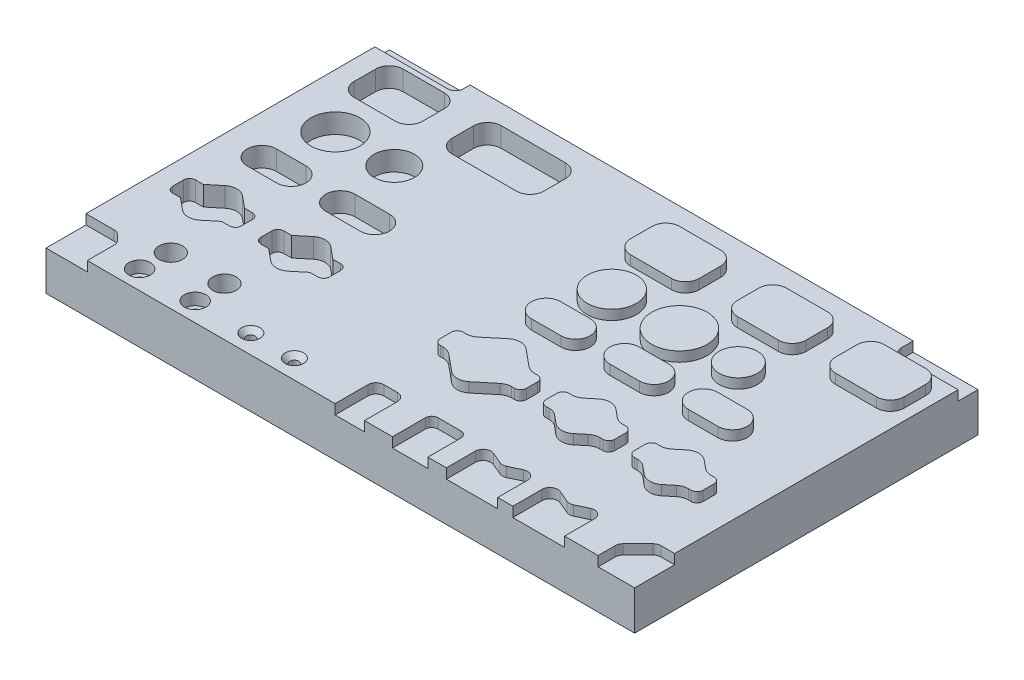
from build123d import *

# Parameters (mm, degrees)
SKETCH1_W                                       = 300
SKETCH1_H                                       = 175
BOSS_EXTRUDE1_DEPTH                             = 25
SKETCH6_R                                       = 12.5
SKETCH6_R_2                                     = 10.290350473
CUT_EXTRUDE2_DEPTH                              = 10
SKETCH8_R                                       = 12.5
SKETCH8_R_2                                     = 9.732410701
SKETCH8_R_3                                     = 14.161785941
BOSS_EXTRUDE2_DEPTH                             = 5
FILLET1_R                                       = 7
F_12_0MM_DOWEL_HOLE1_D                          = 12
F_12_0MM_DOWEL_HOLE1_DEPTH                      = 15
F_12_0MM_DOWEL_HOLE1_TIP                        = 3.605163714
CBORE_FOR_M6_SHCS1_D                            = 6.6
CBORE_FOR_M6_SHCS1_DEPTH                        = 15
CBORE_FOR_M6_SHCS1_CBORE_D                      = 11
CBORE_FOR_M6_SHCS1_CBORE_DEPTH                  = 6
CBORE_FOR_M6_SHCS1_TIP                          = 1.982840043
CSK_FOR_M4_FLAT_HEAD_MACHINE_SCREW1_D           = 4.5
CSK_FOR_M4_FLAT_HEAD_MACHINE_SCREW1_DEPTH       = 15
CSK_FOR_M4_FLAT_HEAD_MACHINE_SCREW1_CSINK_D     = 9.4
CSK_FOR_M4_FLAT_HEAD_MACHINE_SCREW1_CSINK_ANGLE = 90
CSK_FOR_M4_FLAT_HEAD_MACHINE_SCREW1_TIP         = 1.351936393
CUT_EXTRUDE3_DEPTH                              = 5
CUT_EXTRUDE6_DEPTH                              = 5


with BuildPart() as part:
    # Sketch1 → Boss-Extrude1 (new body)
    with BuildSketch(Plane(origin=(0, 0, 0), x_dir=(1, 0, 0), z_dir=(0, 1, 0))):
        with Locations((150, 87.5)):
            Rectangle(SKETCH1_W, SKETCH1_H)
    extrude(amount=-BOSS_EXTRUDE1_DEPTH)

    # Sketch6 → Cut-Extrude2 (cut)
    with BuildSketch(Plane(origin=(0, 0, 0), x_dir=(1, 0, 0), z_dir=(0, 1, 0))):
        with Locations(Location((27.5, 120, 0), (0, 0, 270))):
            Circle(SKETCH6_R)
        with Locations(Location((57.5, 120, 0), (0, 0, 270))):
            Circle(SKETCH6_R_2)
        with BuildLine():
            Line((10, 158), (10, 147))
            ThreePointArc((10, 147), (12.050252532, 142.050252532), (17, 140))
            Line((17, 140), (38, 140))
            ThreePointArc((38, 140), (42.949747468, 142.050252532), (45, 147))
            Line((45, 147), (45, 158))
            ThreePointArc((45, 158), (42.949747468, 162.949747468), (38, 165))
            Line((38, 165), (17, 165))
            ThreePointArc((17, 165), (12.050252532, 162.949747468), (10, 158))
        make_face()
        with BuildLine():
            Line((99.760567467, 165), (67, 165))
            ThreePointArc((67, 165), (62.050252532, 162.949747468), (60, 158))
            Line((60, 158), (60, 147))
            ThreePointArc((60, 147), (62.050252532, 142.050252532), (67, 140))
            Line((67, 140), (99.760567467, 140))
            ThreePointArc((99.760567467, 140), (104.710314935, 142.050252532), (106.760567467, 147))
            Line((106.760567467, 147), (106.760567467, 158))
            ThreePointArc((106.760567467, 158), (104.710314935, 162.949747468), (99.760567467, 165))
        make_face()
        with BuildLine():
            Line((35, 97.5), (20, 97.5))
            ThreePointArc((20, 97.5), (12.5, 90), (20, 82.5))
            Line((20, 82.5), (35, 82.5))
            ThreePointArc((35, 82.5), (42.5, 90), (35, 97.5))
        make_face()
        with BuildLine():
            Line((60, 82.5), (77.590637236, 82.5))
            ThreePointArc((77.590637236, 82.5), (85.090637236, 90), (77.590637236, 97.5))
            Line((77.590637236, 97.5), (60, 97.5))
            ThreePointArc((60, 97.5), (52.5, 90), (60, 82.5))
        make_face()
        with BuildLine():
            Line((45, 54.513667906), (45, 60.176281881))
            ThreePointArc((45, 60.176281881), (44.121320344, 62.297602224), (42, 63.176281881))
            Line((42, 63.176281881), (38, 63.176281881))
            Line((38, 63.176281881), (31.957646777, 68.166805351))
            ThreePointArc((31.957646777, 68.166805351), (27.5, 69.769640798), (23.042353223, 68.166805351))
            Line((23.042353223, 68.166805351), (17, 63.176281881))
            Line((17, 63.176281881), (13, 63.176281881))
            ThreePointArc((13, 63.176281881), (10.878679656, 62.297602224), (10, 60.176281881))
            Line((10, 60.176281881), (10, 54.513667906))
            ThreePointArc((10, 54.513667906), (10.878679656, 52.392347563), (13, 51.513667906))
            Line((13, 51.513667906), (17, 51.513667906))
            Line((17, 51.513667906), (23.042353223, 46.523144436))
            ThreePointArc((23.042353223, 46.523144436), (27.5, 44.920308989), (31.957646777, 46.523144436))
            Line((31.957646777, 46.523144436), (38, 51.513667906))
            Line((38, 51.513667906), (42, 51.513667906))
            ThreePointArc((42, 51.513667906), (44.121320344, 52.392347563), (45, 54.513667906))
        make_face()
        with BuildLine():
            Line((90, 54.513667906), (90, 60.176281881))
            ThreePointArc((90, 60.176281881), (89.121320344, 62.297602224), (87, 63.176281881))
            Line((87, 63.176281881), (83, 63.176281881))
            Line((83, 63.176281881), (76.957646777, 68.166805351))
            ThreePointArc((76.957646777, 68.166805351), (72.5, 69.769640798), (68.042353223, 68.166805351))
            Line((68.042353223, 68.166805351), (62, 63.176281881))
            Line((62, 63.176281881), (58, 63.176281881))
            ThreePointArc((58, 63.176281881), (55.878679656, 62.297602224), (55, 60.176281881))
            Line((55, 60.176281881), (55, 54.513667906))
            ThreePointArc((55, 54.513667906), (55.878679656, 52.392347563), (58, 51.513667906))
            Line((58, 51.513667906), (62, 51.513667906))
            Line((62, 51.513667906), (68.042353223, 46.523144436))
            ThreePointArc((68.042353223, 46.523144436), (72.5, 44.920308989), (76.957646777, 46.523144436))
            Line((76.957646777, 46.523144436), (83, 51.513667906))
            Line((83, 51.513667906), (87, 51.513667906))
            ThreePointArc((87, 51.513667906), (89.121320344, 52.392347563), (90, 54.513667906))
        make_face()
    extrude(amount=-CUT_EXTRUDE2_DEPTH, mode=Mode.SUBTRACT)

    # Sketch8 → Boss-Extrude2 (add)
    with BuildSketch(Plane(origin=(0, 0, 0), x_dir=(1, 0, 0), z_dir=(0, 1, 0))):
        with Locations(Location((172.378649095, 115.997557398, 0), (0, 0, 90))):
            Circle(SKETCH8_R)
        with Locations(Location((236.836295872, 115.997557398, 0), (0, 0, 90))):
            Circle(SKETCH8_R_2)
        with Locations(Location((206.836295872, 115.997557398, 0), (0, 0, 90))):
            Circle(SKETCH8_R_3)
        with BuildLine():
            Line((154.878649095, 153.997557398), (154.878649095, 142.997557398))
            ThreePointArc((154.878649095, 142.997557398), (156.928901627, 138.047809929), (161.878649095, 135.997557398))
            Line((161.878649095, 135.997557398), (182.878649095, 135.997557398))
            ThreePointArc((182.878649095, 135.997557398), (187.828396563, 138.047809929), (189.878649095, 142.997557398))
            Line((189.878649095, 142.997557398), (189.878649095, 153.997557398))
            ThreePointArc((189.878649095, 153.997557398), (187.828396563, 158.947304866), (182.878649095, 160.997557398))
            Line((182.878649095, 160.997557398), (161.878649095, 160.997557398))
            ThreePointArc((161.878649095, 160.997557398), (156.928901627, 158.947304866), (154.878649095, 153.997557398))
        make_face()
        with BuildLine():
            Line((266.336295872, 135.997557398), (287.336295872, 135.997557398))
            ThreePointArc((287.336295872, 135.997557398), (292.286043341, 138.047809929), (294.336295872, 142.997557398))
            Line((294.336295872, 142.997557398), (294.336295872, 153.997557398))
            ThreePointArc((294.336295872, 153.997557398), (292.286043341, 158.947304866), (287.336295872, 160.997557398))
            Line((287.336295872, 160.997557398), (266.336295872, 160.997557398))
            ThreePointArc((266.336295872, 160.997557398), (261.386548404, 158.947304866), (259.336295872, 153.997557398))
            Line((259.336295872, 153.997557398), (259.336295872, 142.997557398))
            ThreePointArc((259.336295872, 142.997557398), (261.386548404, 138.047809929), (266.336295872, 135.997557398))
        make_face()
        with BuildLine():
            Line((209.336295872, 153.997557398), (209.336295872, 142.997557398))
            ThreePointArc((209.336295872, 142.997557398), (211.386548404, 138.047809929), (216.336295872, 135.997557398))
            Line((216.336295872, 135.997557398), (237.336295872, 135.997557398))
            ThreePointArc((237.336295872, 135.997557398), (242.286043341, 138.047809929), (244.336295872, 142.997557398))
            Line((244.336295872, 142.997557398), (244.336295872, 153.997557398))
            ThreePointArc((244.336295872, 153.997557398), (242.286043341, 158.947304866), (237.336295872, 160.997557398))
            Line((237.336295872, 160.997557398), (216.336295872, 160.997557398))
            ThreePointArc((216.336295872, 160.997557398), (211.386548404, 158.947304866), (209.336295872, 153.997557398))
        make_face()
        with BuildLine():
            Line((179.878649095, 97.5), (164.878649095, 97.5))
            ThreePointArc((164.878649095, 97.5), (157.378649095, 90), (164.878649095, 82.5))
            Line((164.878649095, 82.5), (179.878649095, 82.5))
            ThreePointArc((179.878649095, 82.5), (187.378649095, 90), (179.878649095, 97.5))
        make_face()
        with BuildLine():
            Line((259.878649095, 97.5), (244.878649095, 97.5))
            ThreePointArc((244.878649095, 97.5), (237.378649095, 90), (244.878649095, 82.5))
            Line((244.878649095, 82.5), (259.878649095, 82.5))
            ThreePointArc((259.878649095, 82.5), (267.378649095, 90), (259.878649095, 97.5))
        make_face()
        with BuildLine():
            Line((219.878649095, 97.5), (204.878649095, 97.5))
            ThreePointArc((204.878649095, 97.5), (197.378649095, 90), (204.878649095, 82.5))
            Line((204.878649095, 82.5), (219.878649095, 82.5))
            ThreePointArc((219.878649095, 82.5), (227.378649095, 90), (219.878649095, 97.5))
        make_face()
        with BuildLine():
            Line((194.336295872, 50.511225304), (194.336295872, 56.173839279))
            ThreePointArc((194.336295872, 56.173839279), (193.457616216, 58.295159622), (191.336295872, 59.173839279))
            Line((191.336295872, 59.173839279), (187.336295872, 59.173839279))
            Line((187.336295872, 59.173839279), (176.836295872, 67.846039413))
            ThreePointArc((176.836295872, 67.846039413), (172.378649095, 69.448874861), (167.921002318, 67.846039413))
            Line((167.921002318, 67.846039413), (157.421002318, 59.173839279))
            Line((157.421002318, 59.173839279), (153.421002318, 59.173839279))
            ThreePointArc((153.421002318, 59.173839279), (151.299681974, 58.295159622), (150.421002318, 56.173839279))
            Line((150.421002318, 56.173839279), (150.421002318, 50.511225304))
            ThreePointArc((150.421002318, 50.511225304), (151.299681974, 48.38990496), (153.421002318, 47.511225304))
            Line((153.421002318, 47.511225304), (157.421002318, 47.511225304))
            Line((157.421002318, 47.511225304), (167.921002318, 38.839025169))
            ThreePointArc((167.921002318, 38.839025169), (172.378649095, 37.236189722), (176.836295872, 38.839025169))
            Line((176.836295872, 38.839025169), (187.336295872, 47.511225304))
            Line((187.336295872, 47.511225304), (191.336295872, 47.511225304))
            ThreePointArc((191.336295872, 47.511225304), (193.457616216, 48.38990496), (194.336295872, 50.511225304))
        make_face()
        with BuildLine():
            Line((256.336295872, 59.173839279), (252.336295872, 59.173839279))
            ThreePointArc((252.336295872, 59.173839279), (250.214975529, 58.295159622), (249.336295872, 56.173839279))
            Line((249.336295872, 56.173839279), (249.336295872, 50.511225304))
            ThreePointArc((249.336295872, 50.511225304), (250.214975529, 48.38990496), (252.336295872, 47.511225304))
            Line((252.336295872, 47.511225304), (256.336295872, 47.511225304))
            Line((256.336295872, 47.511225304), (262.378649095, 42.520701834))
            ThreePointArc((262.378649095, 42.520701834), (266.836295872, 40.917866387), (271.29394265, 42.520701834))
            Line((271.29394265, 42.520701834), (277.336295872, 47.511225304))
            Line((277.336295872, 47.511225304), (281.336295872, 47.511225304))
            ThreePointArc((281.336295872, 47.511225304), (283.457616216, 48.38990496), (284.336295872, 50.511225304))
            Line((284.336295872, 50.511225304), (284.336295872, 56.173839279))
            ThreePointArc((284.336295872, 56.173839279), (283.457616216, 58.295159622), (281.336295872, 59.173839279))
            Line((281.336295872, 59.173839279), (277.336295872, 59.173839279))
            Line((277.336295872, 59.173839279), (271.29394265, 64.164362748))
            ThreePointArc((271.29394265, 64.164362748), (266.836295872, 65.767198196), (262.378649095, 64.164362748))
            Line((262.378649095, 64.164362748), (256.336295872, 59.173839279))
        make_face()
        with BuildLine():
            Line((217.378649095, 64.164362748), (211.336295872, 59.173839279))
            Line((211.336295872, 59.173839279), (207.336295872, 59.173839279))
            ThreePointArc((207.336295872, 59.173839279), (205.214975529, 58.295159622), (204.336295872, 56.173839279))
            Line((204.336295872, 56.173839279), (204.336295872, 50.511225304))
            ThreePointArc((204.336295872, 50.511225304), (205.214975529, 48.38990496), (207.336295872, 47.511225304))
            Line((207.336295872, 47.511225304), (211.336295872, 47.511225304))
            Line((211.336295872, 47.511225304), (217.378649095, 42.520701834))
            ThreePointArc((217.378649095, 42.520701834), (221.836295872, 40.917866387), (226.29394265, 42.520701834))
            Line((226.29394265, 42.520701834), (232.336295872, 47.511225304))
            Line((232.336295872, 47.511225304), (236.336295872, 47.511225304))
            ThreePointArc((236.336295872, 47.511225304), (238.457616216, 48.38990496), (239.336295872, 50.511225304))
            Line((239.336295872, 50.511225304), (239.336295872, 56.173839279))
            ThreePointArc((239.336295872, 56.173839279), (238.457616216, 58.295159622), (236.336295872, 59.173839279))
            Line((236.336295872, 59.173839279), (232.336295872, 59.173839279))
            Line((232.336295872, 59.173839279), (226.29394265, 64.164362748))
            ThreePointArc((226.29394265, 64.164362748), (221.836295872, 65.767198196), (217.378649095, 64.164362748))
        make_face()
    extrude(amount=BOSS_EXTRUDE2_DEPTH)

    # Fillet1
    fillet1_edges = [part.edges().sort_by_distance(p)[0] for p in [
        (187.336295872, 2.5, -59.173839279),
        (157.421002318, 2.5, -59.173839279),
        (157.421002318, 2.5, -47.511225304),
        (187.336295872, 2.5, -47.511225304),
        (256.336295872, 2.5, -59.173839279),
        (256.336295872, 2.5, -47.511225304),
        (277.336295872, 2.5, -47.511225304),
        (277.336295872, 2.5, -59.173839279),
        (211.336295872, 2.5, -59.173839279),
        (211.336295872, 2.5, -47.511225304),
        (232.336295872, 2.5, -47.511225304),
        (232.336295872, 2.5, -59.173839279),
    ]]
    fillet(fillet1_edges, radius=FILLET1_R)

    # Ø12.0mm Dowel Hole1
    with Locations(Plane(origin=(0, 0, 0), x_dir=(1, 0, 0), z_dir=(0, 1, 0))):
        with Locations((38.850230787, 24.745536241), (66.178636625, 24.745536241)):
            Hole(F_12_0MM_DOWEL_HOLE1_D / 2, depth=F_12_0MM_DOWEL_HOLE1_DEPTH)
            with Locations((0, 0, -(F_12_0MM_DOWEL_HOLE1_DEPTH + F_12_0MM_DOWEL_HOLE1_TIP / 2))):  # 118° drill point
                Cone(0, F_12_0MM_DOWEL_HOLE1_D / 2, F_12_0MM_DOWEL_HOLE1_TIP, mode=Mode.SUBTRACT)

    # CBORE for M6 SHCS1
    with Locations(Plane(origin=(0, 0, 0), x_dir=(1, 0, 0), z_dir=(0, 1, 0))):
        with Locations((38.031254252, 9.675108825), (66.348026594, 9.675108825)):
            CounterBoreHole(CBORE_FOR_M6_SHCS1_D / 2, CBORE_FOR_M6_SHCS1_CBORE_D / 2, CBORE_FOR_M6_SHCS1_CBORE_DEPTH, depth=CBORE_FOR_M6_SHCS1_DEPTH)
            with Locations((0, 0, -(CBORE_FOR_M6_SHCS1_DEPTH + CBORE_FOR_M6_SHCS1_TIP / 2))):  # 118° drill point
                Cone(0, CBORE_FOR_M6_SHCS1_D / 2, CBORE_FOR_M6_SHCS1_TIP, mode=Mode.SUBTRACT)

    # CSK for M4 Flat Head Machine Screw1
    with Locations(Plane(origin=(0, 0, 0), x_dir=(1, 0, 0), z_dir=(0, 1, 0))):
        with Locations((116.904031449, 9.675108825), (94.703782687, 9.675108825)):
            CounterSinkHole(CSK_FOR_M4_FLAT_HEAD_MACHINE_SCREW1_D / 2, CSK_FOR_M4_FLAT_HEAD_MACHINE_SCREW1_CSINK_D / 2, depth=CSK_FOR_M4_FLAT_HEAD_MACHINE_SCREW1_DEPTH, counter_sink_angle=CSK_FOR_M4_FLAT_HEAD_MACHINE_SCREW1_CSINK_ANGLE)
            with Locations((0, 0, -(CSK_FOR_M4_FLAT_HEAD_MACHINE_SCREW1_DEPTH + CSK_FOR_M4_FLAT_HEAD_MACHINE_SCREW1_TIP / 2))):  # 118° drill point
                Cone(0, CSK_FOR_M4_FLAT_HEAD_MACHINE_SCREW1_D / 2, CSK_FOR_M4_FLAT_HEAD_MACHINE_SCREW1_TIP, mode=Mode.SUBTRACT)

    # Sketch18 → Cut-Extrude3 (cut)
    with BuildSketch(Plane(origin=(0, 0, 0), x_dir=(1, 0, 0), z_dir=(0, 1, 0))):
        with BuildLine():
            Line((147.342148887, 0), (162.342148887, 0))
            Line((162.342148887, 0), (162.342148887, 16.801939975))
            ThreePointArc((162.342148887, 16.801939975), (161.170576012, 19.6303671), (158.342148887, 20.801939975))
            Line((158.342148887, 20.801939975), (151.342148887, 20.801939975))
            ThreePointArc((151.342148887, 20.801939975), (148.513721762, 19.6303671), (147.342148887, 16.801939975))
            Line((147.342148887, 16.801939975), (147.342148887, 0))
        make_face()
        with BuildLine():
            Line((176.595254274, 0), (194.595254274, 0))
            Line((194.595254274, 0), (194.595254274, 16.801939975))
            ThreePointArc((194.595254274, 16.801939975), (193.658564179, 19.063309905), (191.397194249, 20))
            Line((191.397194249, 20), (179.793314298, 20))
            ThreePointArc((179.793314298, 20), (177.531944368, 19.063309905), (176.595254274, 16.801939975))
            Line((176.595254274, 16.801939975), (176.595254274, 0))
        make_face()
        with BuildLine():
            Line((209.591859328, 18.454700789), (215.466593681, 15.973044542))
            ThreePointArc((215.466593681, 15.973044542), (217.112041655, 15.658758474), (218.74189477, 16.045867751))
            Line((218.74189477, 16.045867751), (224.48708432, 18.779785537))
            ThreePointArc((224.48708432, 18.779785537), (228.341844479, 18.549825595), (230.205851661, 15.167883153))
            Line((230.205851661, 15.167883153), (230.205851661, 0))
            Line((230.205851661, 0), (204.035325579, 0))
            Line((204.035325579, 0), (204.035325579, 14.769975196))
            ThreePointArc((204.035325579, 14.769975196), (205.824684835, 18.103601975), (209.591859328, 18.454700789))
        make_face()
        with BuildLine():
            Line((243.470743837, 18.583034854), (249.538220786, 16.019958608))
            ThreePointArc((249.538220786, 16.019958608), (251.183668761, 15.70567254), (252.813521876, 16.092781817))
            Line((252.813521876, 16.092781817), (258.558711426, 18.826699602))
            ThreePointArc((258.558711426, 18.826699602), (262.413471585, 18.596739661), (264.277478767, 15.214797219))
            Line((264.277478767, 15.214797219), (264.277478767, 0))
            Line((264.277478767, 0), (237.914210089, 0))
            Line((237.914210089, 0), (237.914210089, 14.898309262))
            ThreePointArc((237.914210089, 14.898309262), (239.703569344, 18.23193604), (243.470743837, 18.583034854))
        make_face()
    extrude(amount=-CUT_EXTRUDE3_DEPTH, mode=Mode.SUBTRACT)

    # Sketch21 → Cut-Extrude6 (cut)
    with BuildSketch(Plane(origin=(0, 0, 0), x_dir=(1, 0, 0), z_dir=(0, 1, 0))):
        with BuildLine():
            Line((300, 164.893929043), (270.984646786, 164.893929043))
            ThreePointArc((270.984646786, 164.893929043), (268.156219662, 166.065501919), (266.984646786, 168.893929043))
            Line((266.984646786, 168.893929043), (266.984646786, 175))
            Line((266.984646786, 175), (300, 175))
            Line((300, 175), (300, 164.893929043))
        make_face()
        with BuildLine():
            Line((290.223099173, 19.198397599), (282.566244923, 11.541543349))
            ThreePointArc((282.566244923, 11.541543349), (281.699153918, 10.243849954), (281.394672048, 8.713116225))
            Line((281.394672048, 8.713116225), (281.394672048, 0))
            Line((281.394672048, 0), (300, 0))
            Line((300, 0), (300, 20.369970474))
            Line((300, 20.369970474), (293.051526298, 20.369970474))
            ThreePointArc((293.051526298, 20.369970474), (291.520792568, 20.065488604), (290.223099173, 19.198397599))
        make_face()
        with BuildLine():
            Line((0, 175), (41.083972916, 175))
            Line((41.083972916, 175), (41.083972916, 171.618406878))
            ThreePointArc((41.083972916, 171.618406878), (39.912400041, 168.789979753), (37.083972916, 167.618406878))
            Line((37.083972916, 167.618406878), (0, 167.618406878))
            Line((0, 167.618406878), (0, 175))
        make_face()
        with BuildLine():
            Line((17.218873096, 19.198397599), (19.875727346, 16.541543349))
            ThreePointArc((19.875727346, 16.541543349), (20.742818351, 15.243849954), (21.047300221, 13.713116225))
            Line((21.047300221, 13.713116225), (21.047300221, 0))
            Line((21.047300221, 0), (0, 0))
            Line((0, 0), (0, 20.369970474))
            Line((0, 20.369970474), (14.390445971, 20.369970474))
            ThreePointArc((14.390445971, 20.369970474), (15.921179701, 20.065488604), (17.218873096, 19.198397599))
        make_face()
    extrude(amount=-CUT_EXTRUDE6_DEPTH, mode=Mode.SUBTRACT)


solid = part.part
